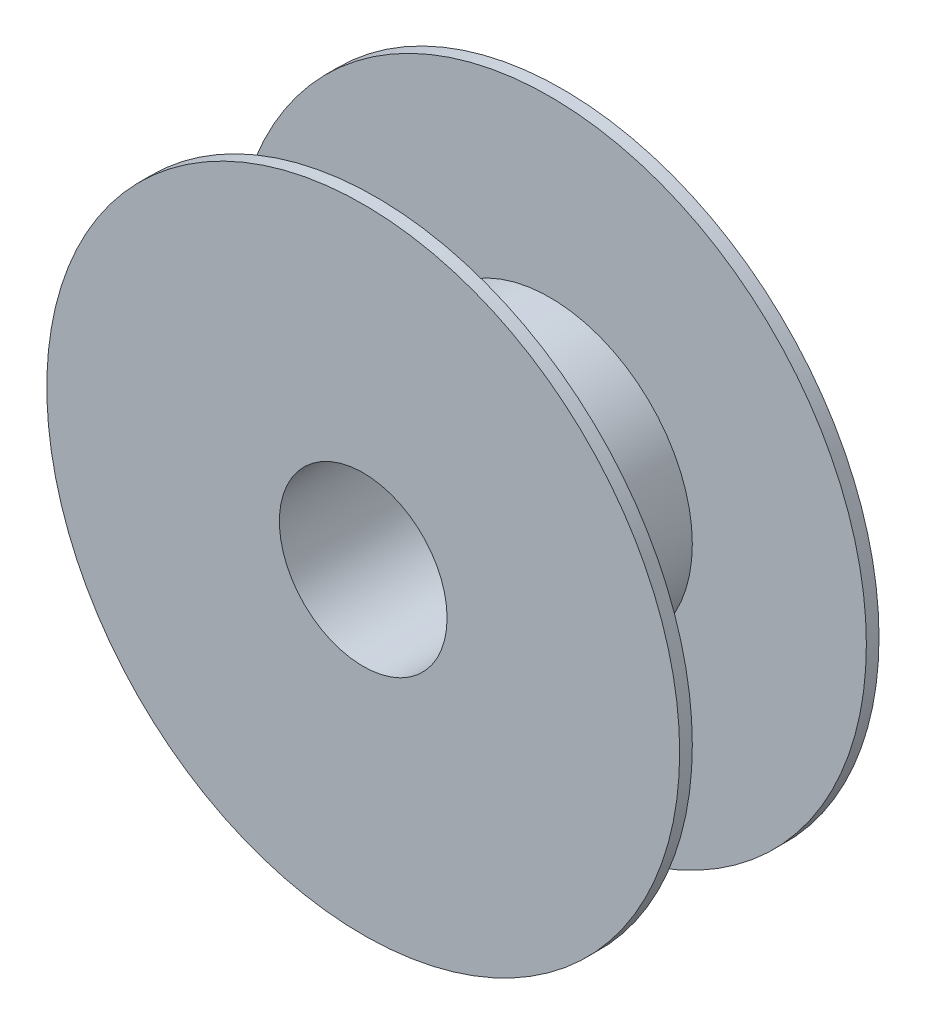
from build123d import *

# Parameters (mm, degrees)
SKETCH1_R           = 100
SKETCH1_R_2         = 26.5
BOSS_EXTRUDE1_DEPTH = 31.5
SKETCH2_R           = 100
SKETCH2_R_2         = 45
CUT_EXTRUDE1_DEPTH  = 27.5


with BuildPart() as part:
    # Sketch1 → Boss-Extrude1 (new, symmetric)
    with BuildSketch(Plane.XY):
        Circle(SKETCH1_R)
        Circle(SKETCH1_R_2, mode=Mode.SUBTRACT)
    extrude(amount=BOSS_EXTRUDE1_DEPTH, both=True)

    # Sketch2 → Cut-Extrude1 (cut, symmetric)
    with BuildSketch(Plane.XY):
        Circle(SKETCH2_R)
        Circle(SKETCH2_R_2, mode=Mode.SUBTRACT)
    extrude(amount=CUT_EXTRUDE1_DEPTH, both=True, mode=Mode.SUBTRACT)


solid = part.part
